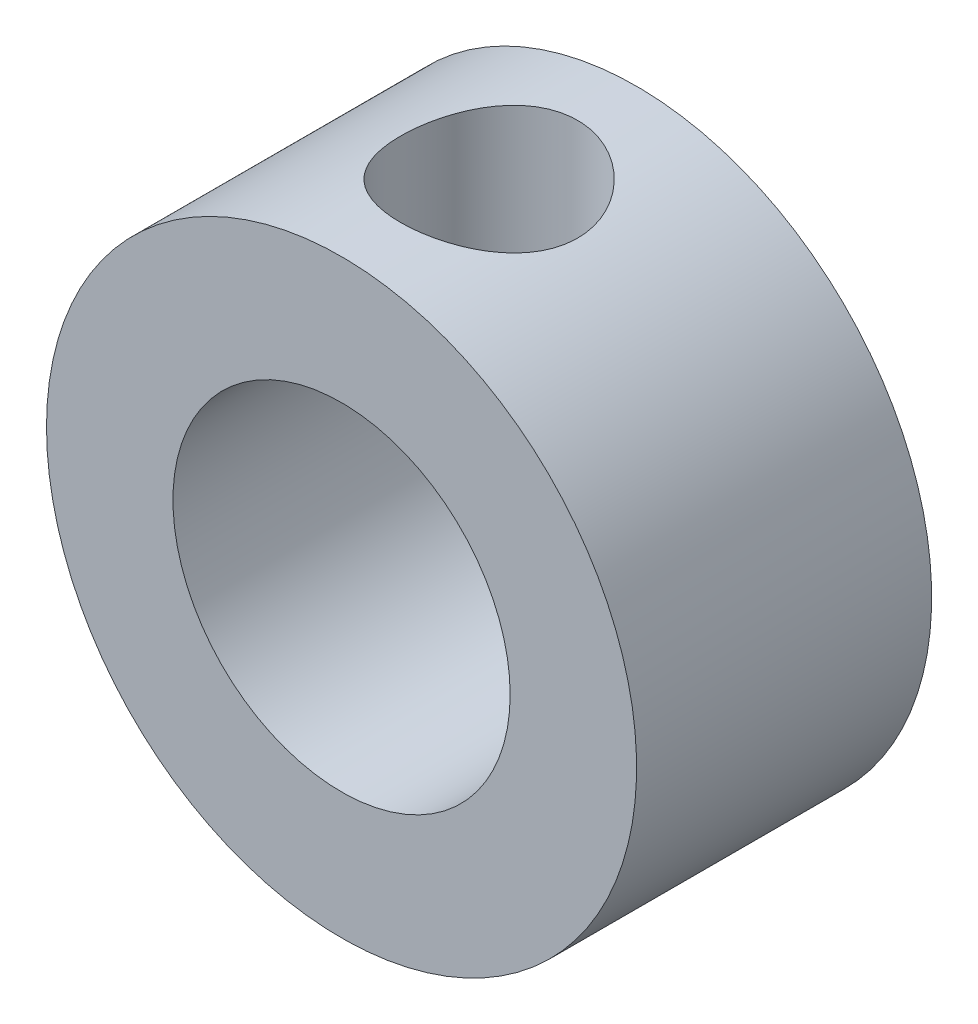
from build123d import *

# Parameters (mm, degrees)
SKETCH1_W                       = 7
SKETCH1_H                       = 7
F_8_0_8_DIAMETER_HOLE1_D        = 8
F_4_2_4_2_DIAMETER_HOLE1_REACH  = 18.039
F_4_2_4_2_DIAMETER_HOLE1_BORE_R = 2.1


with BuildPart() as part:
    # Sketch1 → Revolve1 (revolve)
    with BuildSketch(Plane.XZ, mode=Mode.PRIVATE) as revolve1_sk:
        with Locations((3.5, 3.5)):
            Rectangle(SKETCH1_W, SKETCH1_H)
    revolve(revolve1_sk.sketch.rotate(Axis((0, 0, 7), (0, 0, -1)), 180), axis=Axis((0, 0, 7), (0, 0, -1)))

    # Ø8.0 (8) Diameter Hole1 (through all)
    with Locations(Plane.XY.offset(7)):
        with Locations((0, 0)):
            Hole(F_8_0_8_DIAMETER_HOLE1_D / 2)

    # Ø4.2 (4.2) Diameter Hole1 bore (on position points) → Ø4.2 (4.2) Diameter Hole1 (cut, up to next)
    with BuildSketch(Plane(origin=(0, 7, 3.5), x_dir=(1, 0, 0), z_dir=(0, 1, 0)), mode=Mode.PRIVATE) as f_4_2_4_2_diameter_hole1_sk1:
        Circle(F_4_2_4_2_DIAMETER_HOLE1_BORE_R)
    f_4_2_4_2_diameter_hole1_tool1 = extrude(f_4_2_4_2_diameter_hole1_sk1.sketch, amount=-F_4_2_4_2_DIAMETER_HOLE1_REACH, mode=Mode.PRIVATE) & part.part
    add(f_4_2_4_2_diameter_hole1_tool1.solids().sort_by_distance((0, 7, 3.5))[0], mode=Mode.SUBTRACT)


solid = part.part
